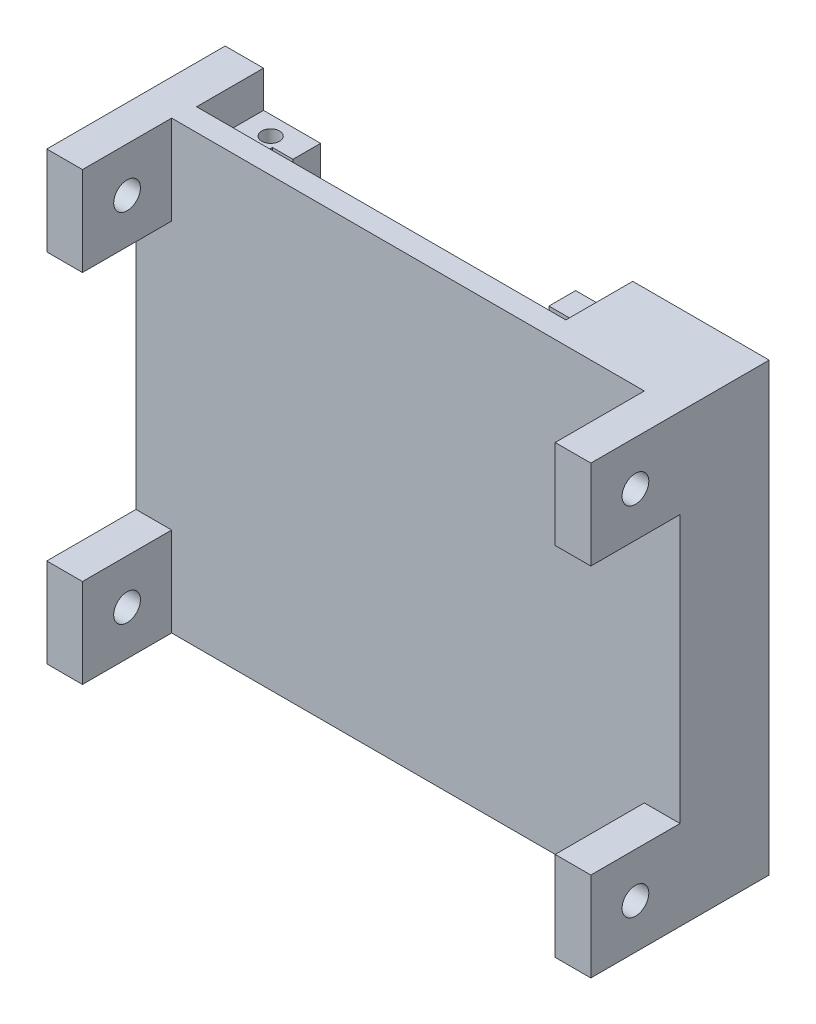
from build123d import *

# Parameters (mm, degrees)
SKETCH1_W                = 10
SKETCH1_H                = 20
BOSS_EXTRUDE2_DEPTH      = 10
SKETCH3_W                = 10
SKETCH3_H                = 20
BOSS_EXTRUDE3_DEPTH      = 10
SKETCH4_W                = 62.5
SKETCH4_H                = 5
BOSS_EXTRUDE4_DEPTH      = 10
SKETCH6_R                = 1
CUT_EXTRUDE1_DEPTH       = 10
CUT_EXTRUDE3_START       = -10
SKETCH10_R               = 1
CUT_EXTRUDE3_DEPTH       = 10
SKETCH11_W               = 50
SKETCH11_H               = 50
BOSS_EXTRUDE8_DEPTH      = 10
SKETCH18_W               = 10
SKETCH18_H               = 10
BOSS_EXTRUDE9_DEPTH      = 6
SKETCH20_W               = 10
SKETCH20_H               = 10
BOSS_EXTRUDE10_DEPTH     = 12
SKETCH23_W               = 28.6
SKETCH23_H               = 45
CUT_EXTRUDE10_DEPTH      = 7.5
SKETCH24_W               = 6.4
SKETCH24_H               = 7.5
CUT_EXTRUDE11_DEPTH      = 4.1
SKETCH25_W               = 2.3
SKETCH25_H               = 2.5
CUT_EXTRUDE12_DEPTH      = 41
SKETCH26_W               = 2.3
SKETCH26_H               = 2.4
CUT_EXTRUDE13_DEPTH      = 41
SKETCH27_R               = 1
CUT_EXTRUDE14_DEPTH      = 10
SKETCH28_R               = 1
CUT_EXTRUDE15_DEPTH      = 10
SKETCH31_W               = 12.5
SKETCH31_H               = 10
BOSS_EXTRUDE11_DEPTH     = 5
SKETCH32_W               = 10
SKETCH32_H               = 10
CUT_EXTRUDE16_DEPTH      = 7.5
CUT_EXTRUDE17_DEPTH      = 7.5
SKETCH33_W               = 10
SKETCH33_H               = 10
BOSS_EXTRUDE12_DEPTH     = 5
SKETCH34_W               = 10
SKETCH34_H               = 10
BOSS_EXTRUDE13_DEPTH     = 5
SKETCH35_W               = 10
SKETCH35_H               = 10
BOSS_EXTRUDE14_DEPTH     = 3.5
SKETCH36_W               = 10
SKETCH36_H               = 10
BOSS_EXTRUDE15_DEPTH     = 9.5
CUT_EXTRUDE18_DEPTH      = 90.5
CUT_EXTRUDE18_DEPTH_BACK = 15.5
SKETCH37_R               = 1.25
CUT_EXTRUDE19_DEPTH      = 88.5
CUT_EXTRUDE19_DEPTH_BACK = 15.5
SKETCH38_R               = 1.25
SKETCH39_W               = 29.967126749
SKETCH39_H               = 31.835751001
SKETCH39_W_2             = 15.617210398
SKETCH39_H_2             = 32.298255859
CUT_EXTRUDE20_DEPTH      = 36
SKETCH40_W               = 10
SKETCH40_H               = 50
BOSS_EXTRUDE16_DEPTH     = 11
SKETCH41_W               = 4
SKETCH41_H               = 10
BOSS_EXTRUDE17_DEPTH     = 10
SKETCH42_R               = 1.5
CUT_EXTRUDE21_DEPTH      = 80


with BuildPart() as part:
    # Sketch1 → Boss-Extrude2 (new body)
    with BuildSketch(Plane(origin=(0, 0, 0), x_dir=(1, 0, 0), z_dir=(0, 1, 0))):
        with Locations((5, 10)):
            Rectangle(SKETCH1_W, SKETCH1_H)
    extrude(amount=BOSS_EXTRUDE2_DEPTH)



with BuildPart() as body_2:
    # Sketch3 → Boss-Extrude3 (new body)
    with BuildSketch(Plane(origin=(0, 0, 0), x_dir=(1, 0, 0), z_dir=(0, 1, 0))):
        with Locations((77.5, 10)):
            Rectangle(SKETCH3_W, SKETCH3_H)
    extrude(amount=BOSS_EXTRUDE3_DEPTH)


with BuildPart() as part_1:
    add(part.part)

    add(body_2.part)  # Boss-Extrude4 merges body 2
    # Sketch4 → Boss-Extrude4 (add)
    with BuildSketch(Plane(origin=(0, 0, 0), x_dir=(1, 0, 0), z_dir=(0, 1, 0))):
        with Locations((41.25, 10)):
            Rectangle(SKETCH4_W, SKETCH4_H)
    extrude(amount=BOSS_EXTRUDE4_DEPTH)

    # Sketch6 → Cut-Extrude1 (cut)
    with BuildSketch(Plane(origin=(10, 0, 0), x_dir=(0, 0, -1), z_dir=(1, 0, 0))):
        with Locations((16.25, 5)):
            Circle(SKETCH6_R)
    extrude(amount=-CUT_EXTRUDE1_DEPTH, mode=Mode.SUBTRACT)

    # Sketch10 → Cut-Extrude3 (cut)
    with BuildSketch(Plane.ZY.offset(-72.5).offset(CUT_EXTRUDE3_START)):
        with Locations(Location((-16.25, 5, 0), (0, 0, 180))):
            Circle(SKETCH10_R)
    extrude(amount=CUT_EXTRUDE3_DEPTH, mode=Mode.SUBTRACT)

    # Sketch11 → Boss-Extrude8 (add)
    with BuildSketch(Plane(origin=(0, 0, -12.5), x_dir=(-1, 0, 0), z_dir=(0, 0, -1))):
        with Locations((-35, 20)):
            Rectangle(SKETCH11_W, SKETCH11_H)
    extrude(amount=-BOSS_EXTRUDE8_DEPTH)

    # Sketch18 → Boss-Extrude9 (add)
    with BuildSketch(Plane.XY):
        with Locations((5, 5)):
            Rectangle(SKETCH18_W, SKETCH18_H)
    extrude(amount=BOSS_EXTRUDE9_DEPTH)

    # Sketch20 → Boss-Extrude10 (add)
    with BuildSketch(Plane.XZ):
        with Locations((77.5, -7.5)):
            Rectangle(SKETCH20_W, SKETCH20_H)
        with Locations((5, -7.5)):
            Rectangle(SKETCH20_W, SKETCH20_H)
    extrude(amount=BOSS_EXTRUDE10_DEPTH)

    # Sketch23 → Cut-Extrude10 (cut)
    with BuildSketch(Plane(origin=(0, 0, -12.5), x_dir=(-1, 0, 0), z_dir=(0, 0, -1))):
        with Locations((-35, 22.5)):
            Rectangle(SKETCH23_W, SKETCH23_H)
    extrude(amount=-CUT_EXTRUDE10_DEPTH, mode=Mode.SUBTRACT)

    # Sketch24 → Cut-Extrude11 (cut)
    with BuildSketch(Plane(origin=(0, 45, 0), x_dir=(1, 0, 0), z_dir=(0, 1, 0))):
        with Locations((17.5, 8.75)):
            Rectangle(SKETCH24_W, SKETCH24_H)
        with Locations((52.5, 8.75)):
            Rectangle(SKETCH24_W, SKETCH24_H)
    extrude(amount=-CUT_EXTRUDE11_DEPTH, mode=Mode.SUBTRACT)

    # Sketch25 → Cut-Extrude12 (cut)
    with BuildSketch(Plane(origin=(0, 40.9, 0), x_dir=(1, 0, 0), z_dir=(0, 1, 0))):
        with Locations((50.45, 8.25)):
            Rectangle(SKETCH25_W, SKETCH25_H)
    extrude(amount=-CUT_EXTRUDE12_DEPTH, mode=Mode.SUBTRACT)

    # Sketch26 → Cut-Extrude13 (cut)
    with BuildSketch(Plane(origin=(0, 40.9, 0), x_dir=(1, 0, 0), z_dir=(0, 1, 0))):
        with Locations((19.55, 8.2)):
            Rectangle(SKETCH26_W, SKETCH26_H)
    extrude(amount=-CUT_EXTRUDE13_DEPTH, mode=Mode.SUBTRACT)

    # Sketch27 → Cut-Extrude14 (cut)
    with BuildSketch(Plane(origin=(0, 40.9, 0), x_dir=(1, 0, 0), z_dir=(0, 1, 0))):
        with Locations(Location((17.2, 10.4, 0), (0, 0, 270))):
            Circle(SKETCH27_R)
    extrude(amount=-CUT_EXTRUDE14_DEPTH, mode=Mode.SUBTRACT)

    # Sketch28 → Cut-Extrude15 (cut)
    with BuildSketch(Plane(origin=(0, 40.9, 0), x_dir=(1, 0, 0), z_dir=(0, 1, 0))):
        with Locations(Location((52.8, 10.4, 0), (0, 0, 270))):
            Circle(SKETCH28_R)
    extrude(amount=-CUT_EXTRUDE15_DEPTH, mode=Mode.SUBTRACT)

    # Sketch31 → Boss-Extrude11 (add)
    with BuildSketch(Plane.XY.offset(-7.5)):
        with Locations((66.25, 5)):
            Rectangle(SKETCH31_W, SKETCH31_H)
    extrude(amount=BOSS_EXTRUDE11_DEPTH)

    # Sketch32 → Cut-Extrude16 (cut)
    with BuildSketch(Plane(origin=(0, 0, -20), x_dir=(-1, 0, 0), z_dir=(0, 0, -1))):
        with Locations((-77.5, 5)):
            Rectangle(SKETCH32_W, SKETCH32_H)
    extrude(amount=-CUT_EXTRUDE16_DEPTH, mode=Mode.SUBTRACT)

    # 3DSketch1 → Cut-Extrude17 (cut)
    with BuildSketch(Plane(origin=(10, 0, -20), x_dir=(-0.7071067811865476, 0.7071067811865476, 0), z_dir=(0, 0, 1))):
        Polygon((0, 0), (7.071067812, 7.071067812), (14.142135624, 0), (7.071067812, -7.071067812), align=None)
    extrude(amount=CUT_EXTRUDE17_DEPTH, mode=Mode.SUBTRACT)

    # Sketch33 → Boss-Extrude12 (add)
    with BuildSketch(Plane.XZ.offset(12)):
        with Locations((5, -7.5)):
            Rectangle(SKETCH33_W, SKETCH33_H)
    extrude(amount=BOSS_EXTRUDE12_DEPTH)

    # Sketch34 → Boss-Extrude13 (add)
    with BuildSketch(Plane.XZ.offset(12)):
        with Locations((77.5, -7.5)):
            Rectangle(SKETCH34_W, SKETCH34_H)
    extrude(amount=BOSS_EXTRUDE13_DEPTH)

    # Sketch35 → Boss-Extrude14 (add)
    with BuildSketch(Plane.XY.offset(6)):
        with Locations((5, 5)):
            Rectangle(SKETCH35_W, SKETCH35_H)
    extrude(amount=BOSS_EXTRUDE14_DEPTH)

    # Sketch36 → Boss-Extrude15 (add)
    with BuildSketch(Plane.XY):
        with Locations((77.5, 5)):
            Rectangle(SKETCH36_W, SKETCH36_H)
    extrude(amount=BOSS_EXTRUDE15_DEPTH)

    # Sketch37 → Cut-Extrude18 (cut, two sides: drawn at the far end of the back side and taken through both)
    with BuildSketch(Plane(origin=(10, 0, 0), x_dir=(0, 0, -1), z_dir=(1, 0, 0)).offset(-CUT_EXTRUDE18_DEPTH_BACK)):
        with Locations(Location((-3.5, 5, 0), (0, 0, 180))):
            Circle(SKETCH37_R)
    extrude(amount=CUT_EXTRUDE18_DEPTH + CUT_EXTRUDE18_DEPTH_BACK, mode=Mode.SUBTRACT)

    # Sketch38 → Cut-Extrude19 (cut, two sides: drawn at the far end of the back side and taken through both)
    with BuildSketch(Plane(origin=(10, 0, 0), x_dir=(0, 0, -1), z_dir=(1, 0, 0)).offset(-CUT_EXTRUDE19_DEPTH_BACK)):
        with Locations(Location((7.5, -11, 0), (0, 0, 180))):
            Circle(SKETCH38_R)
    extrude(amount=CUT_EXTRUDE19_DEPTH + CUT_EXTRUDE19_DEPTH_BACK, mode=Mode.SUBTRACT)

    # Sketch39 → Cut-Extrude20 (cut)
    with BuildSketch(Plane(origin=(0, 0, -12.5), x_dir=(-1, 0, 0), z_dir=(0, 0, -1))):
        with Locations((-74.983563375, -4.30748393)):
            Rectangle(SKETCH39_W, SKETCH39_H)
        with Locations((-2.191394801, -3.536642501)):
            Rectangle(SKETCH39_W_2, SKETCH39_H_2)
    extrude(amount=-CUT_EXTRUDE20_DEPTH, mode=Mode.SUBTRACT)

    # Sketch40 → Boss-Extrude16 (add)
    with BuildSketch(Plane(origin=(60, 0, 0), x_dir=(0, 0, -1), z_dir=(1, 0, 0))):
        with Locations((7.5, 20)):
            Rectangle(SKETCH40_W, SKETCH40_H)
    extrude(amount=BOSS_EXTRUDE16_DEPTH)

    # Sketch41 → Boss-Extrude17 (add)
    with BuildSketch(Plane.XY.offset(-2.5)):
        with Locations((12, 40)):
            Rectangle(SKETCH41_W, SKETCH41_H)
        with Locations((12, 0)):
            Rectangle(SKETCH41_W, SKETCH41_H)
        with Locations((69, 40)):
            Rectangle(SKETCH41_W, SKETCH41_H)
        with Locations((69, 0)):
            Rectangle(SKETCH41_W, SKETCH41_H)
    extrude(amount=BOSS_EXTRUDE17_DEPTH)

    # Sketch42 → Cut-Extrude21 (cut)
    with BuildSketch(Plane(origin=(71, 0, 0), x_dir=(0, 0, -1), z_dir=(1, 0, 0))):
        with Locations(Location((-2.5, 0, 0), (0, 0, 90))):
            Circle(SKETCH42_R)
        with Locations(Location((-2.5, 40, 0), (0, 0, 90))):
            Circle(SKETCH42_R)
    extrude(amount=-CUT_EXTRUDE21_DEPTH, mode=Mode.SUBTRACT)


solid = part_1.part
